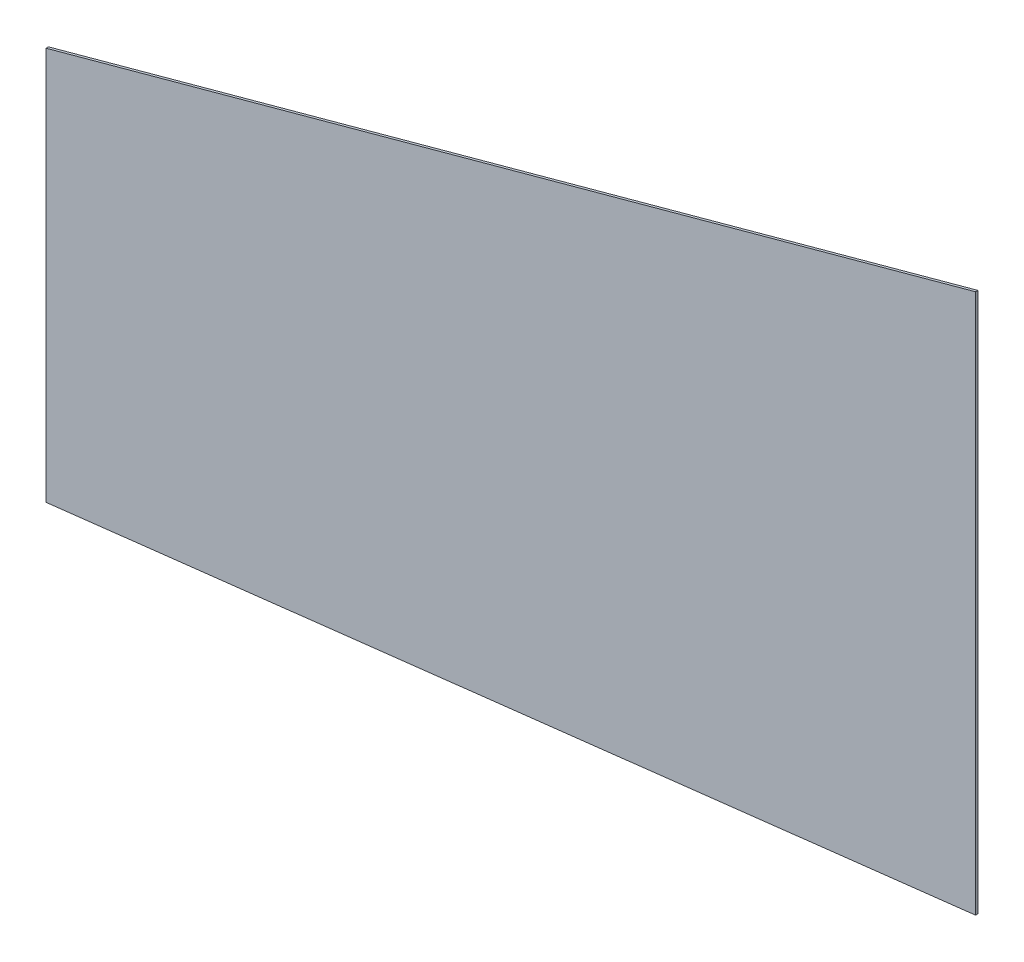
from build123d import *

# Parameters (mm, degrees)
EXTRUDE_1_DEPTH = 2


with BuildPart() as part:
    # ｽｹｯﾁ1 → ﾎﾞｽ - 押し出し1 (new body)
    with BuildSketch(Plane.XY):
        Polygon((0, 330), (0, 0), (780, 90), (780, 543), align=None)
    extrude(amount=EXTRUDE_1_DEPTH)


solid = part.part
